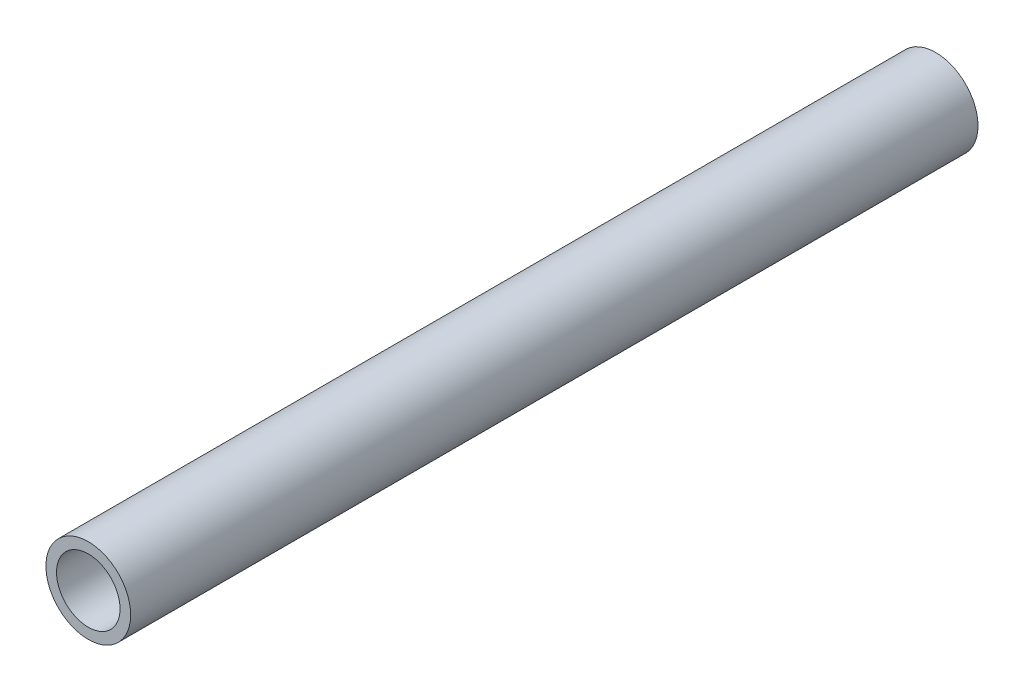
from build123d import *

# Parameters (mm, degrees)
SKETCH_1_R      = 8
SKETCH_1_R_2    = 6
EXTRUDE_1_DEPTH = 160


with BuildPart() as part:
    # 草图1 → 凸台-拉伸1 (new body)
    with BuildSketch(Plane.XY):
        Circle(SKETCH_1_R)
        Circle(SKETCH_1_R_2, mode=Mode.SUBTRACT)
    extrude(amount=EXTRUDE_1_DEPTH)


solid = part.part
